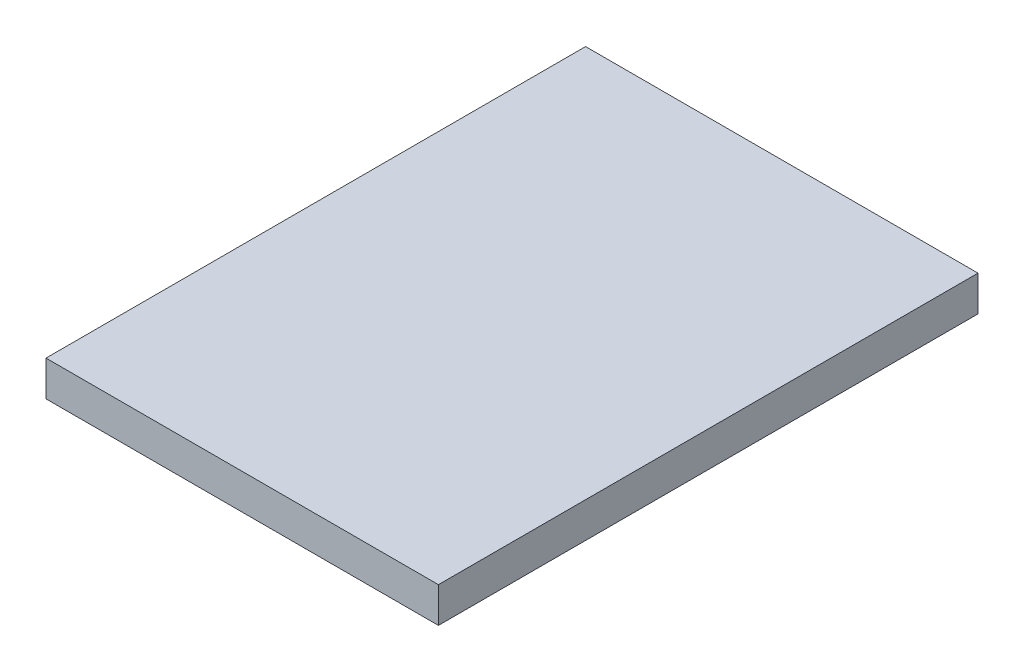
from build123d import *

# Parameters (mm, degrees)
SKETCH1_W           = 203.2
SKETCH1_H           = 279.4
BOSS_EXTRUDE1_DEPTH = 18.288


with BuildPart() as part:
    # Sketch1 → Boss-Extrude1 (new body)
    with BuildSketch(Plane(origin=(0, 0, 0), x_dir=(1, 0, 0), z_dir=(0, 1, 0))):
        Rectangle(SKETCH1_W, SKETCH1_H)
    extrude(amount=BOSS_EXTRUDE1_DEPTH)


solid = part.part
